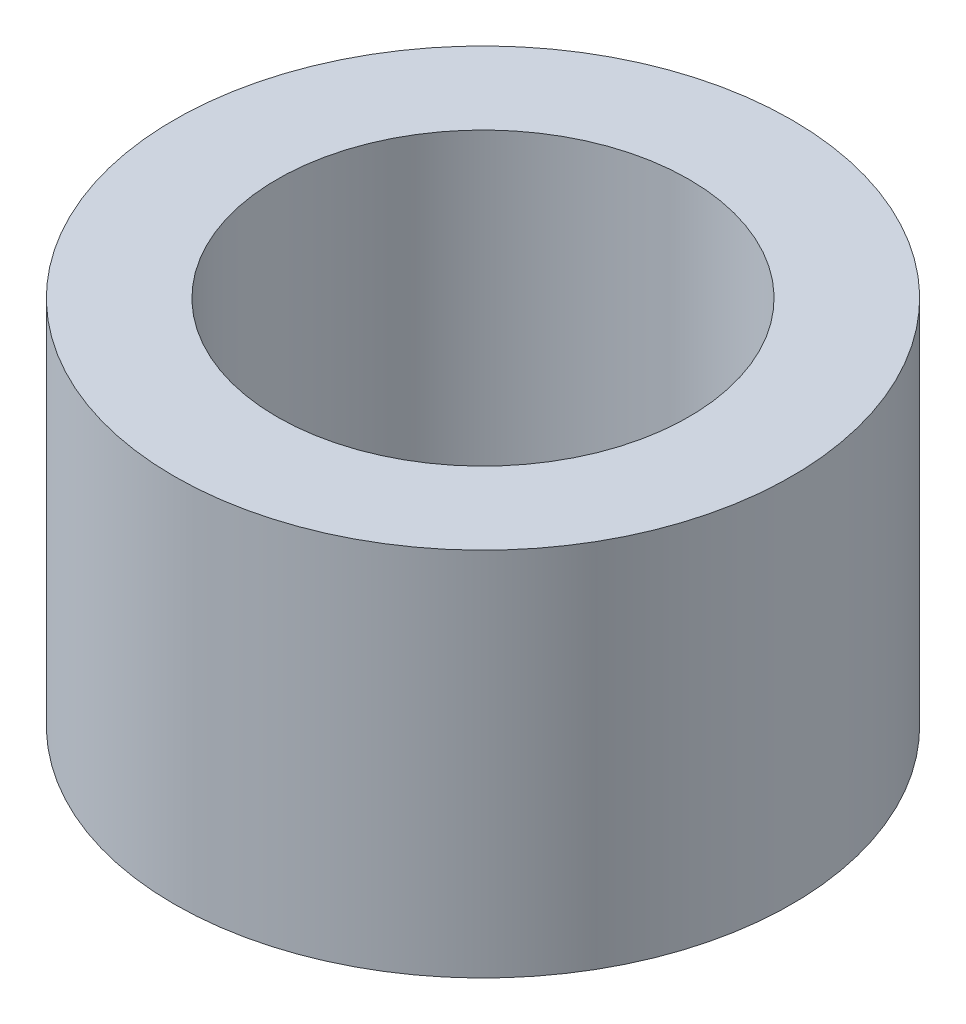
from build123d import *

# Parameters (mm, degrees)
SKETCH_1_R      = 3
SKETCH_1_R_2    = 2
EXTRUDE_1_DEPTH = 3.6


with BuildPart() as part:
    # Эскиз1 → Бобышка-Вытянуть1 (new body)
    with BuildSketch(Plane(origin=(0, 0, 0), x_dir=(1, 0, 0), z_dir=(0, 1, 0))):
        with Locations(Location((0, 0, 0), (0, 0, 270))):
            Circle(SKETCH_1_R)
        with Locations(Location((0, 0, 0), (0, 0, 270))):
            Circle(SKETCH_1_R_2, mode=Mode.SUBTRACT)
    extrude(amount=EXTRUDE_1_DEPTH)


solid = part.part
